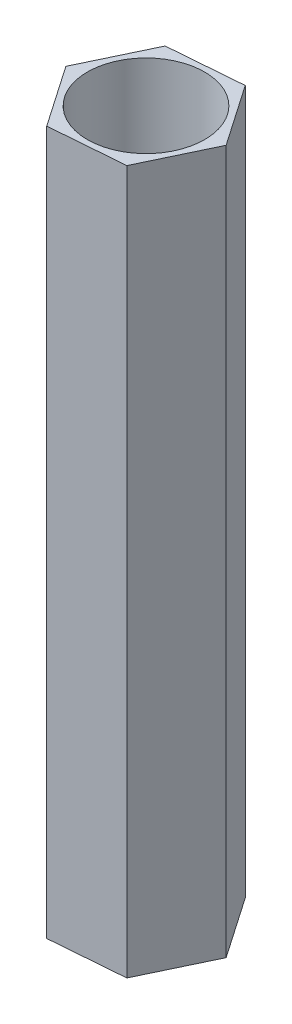
from build123d import *

# Parameters (mm, degrees)
SKETCH1_R           = 1.5
BOSS_EXTRUDE1_DEPTH = 18


with BuildPart() as part:
    # Sketch1 → Boss-Extrude1 (new body)
    with BuildSketch(Plane(origin=(0, 0, 0), x_dir=(1, 0, 0), z_dir=(0, 1, 0))):
        Polygon((1.080098509, -1.569518146), (1.899291841, 0.150633674), (0.819193332, 1.72015182), (-1.080098509, 1.569518146), (-1.899291841, -0.150633674), (-0.819193332, -1.72015182), align=None)
        with Locations(Location((0, 0, 0), (0, 0, 270))):
            Circle(SKETCH1_R, mode=Mode.SUBTRACT)
    extrude(amount=BOSS_EXTRUDE1_DEPTH)


solid = part.part
